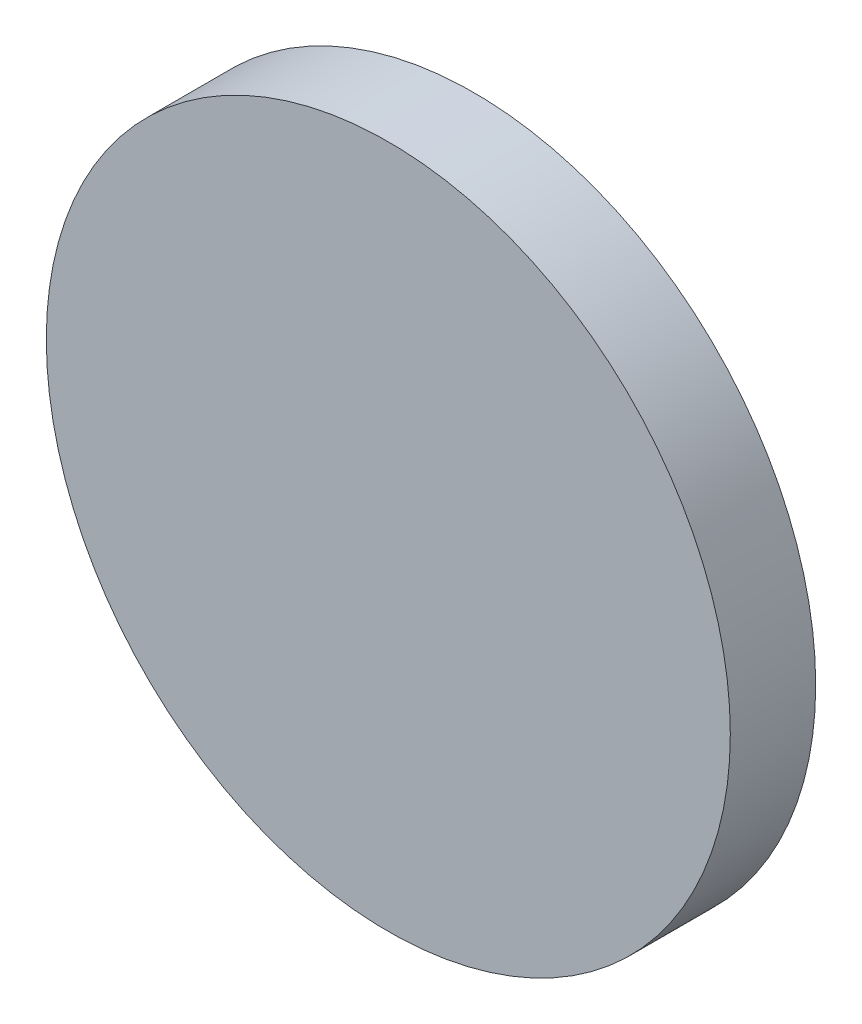
from build123d import *

# Parameters (mm, degrees)
SKETCH_1_R      = 200.288008157
EXTRUDE_1_DEPTH = 50


with BuildPart() as part:
    # Эскиз1 → Бобышка-Вытянуть1 (new body)
    with BuildSketch(Plane.XY):
        with Locations((-8.131100847, -7.046467535)):
            Circle(SKETCH_1_R)
    extrude(amount=EXTRUDE_1_DEPTH)


solid = part.part
